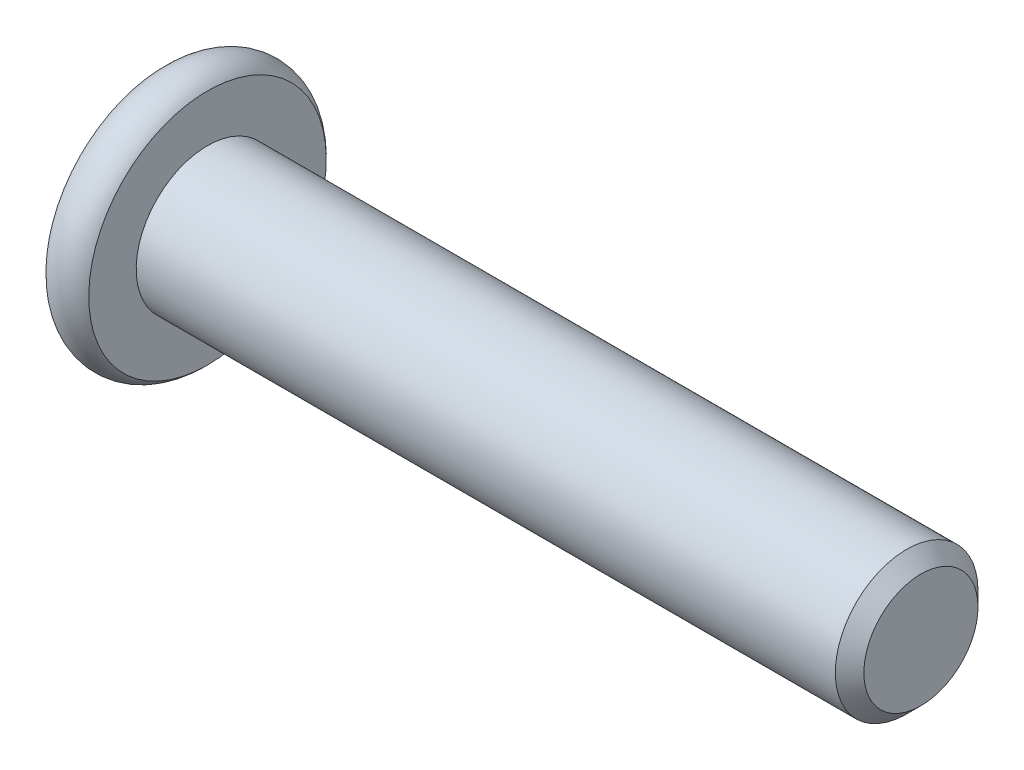
from build123d import *

# Parameters (mm, degrees)
SKETCH2_R           = 2.5
BOSS_EXTRUDE1_DEPTH = 25
CHAMFER1_SIZE       = 0.5
CUT_EXTRUDE1_DEPTH  = 2.3
SKETCH8_R           = 1.782050808
CUT_EXTRUDE2_DEPTH  = 1
CUT_EXTRUDE2_DRAFT  = -45


with BuildPart() as part:
    # Sketch2 → Boss-Extrude1 (new body)
    with BuildSketch(Plane(origin=(0, 0, 0), x_dir=(0, 0, -1), z_dir=(1, 0, 0))):
        Circle(SKETCH2_R)
    extrude(amount=-BOSS_EXTRUDE1_DEPTH)

    # Chamfer1
    chamfer1_edges = [part.edges().sort_by_distance(p)[0] for p in [
        (0, 0, 2.5),
    ]]
    chamfer(chamfer1_edges, length=CHAMFER1_SIZE)

    # Sketch6 → Revolve1 (revolve)
    with BuildSketch(Plane.XY):
        with BuildLine():
            Line((-26.5, 0), (-26.5, 4.161437828))
            ThreePointArc((-26.5, 4.161437828), (-25.75, 4.5), (-25, 4.161437828))
            Line((-25, 4.161437828), (-25, 0))
            Line((-25, 0), (-26.5, 0))
        make_face()
    revolve(axis=Axis((-25, 0, 0), (1, 0, 0)))

    # Sketch7 → Cut-Extrude1 (cut)
    with BuildSketch(Plane.ZY.offset(26.5)):
        Polygon((0, 1.732050808), (-1.5, 0.866025404), (-1.5, -0.866025404), (0, -1.732050808), (1.5, -0.866025404), (1.5, 0.866025404), align=None)
    extrude(amount=-CUT_EXTRUDE1_DEPTH, mode=Mode.SUBTRACT)


with BuildPart() as cut_extrude2_tool:
    # Sketch8 → Cut-Extrude2 (with draft: the straight prism first)
    with BuildSketch(Plane.ZY.offset(26.5)):
        Circle(SKETCH8_R)
    extrude(amount=-CUT_EXTRUDE2_DEPTH)
    # Cut-Extrude2: the draft: its side faces are tilted about the plane it starts from
    cut_extrude2_sides = [cut_extrude2_tool.faces().sort_by_distance(p)[0] for p in [
        (-26, 0, -1.782050808),
    ]]
    draft(cut_extrude2_sides, Plane.ZY.offset(26.5), CUT_EXTRUDE2_DRAFT)


with BuildPart() as part_1:
    add(part.part)

    # Cut-Extrude2: cut by cut_extrude2_tool
    add(cut_extrude2_tool.part, mode=Mode.SUBTRACT)


solid = part_1.part
